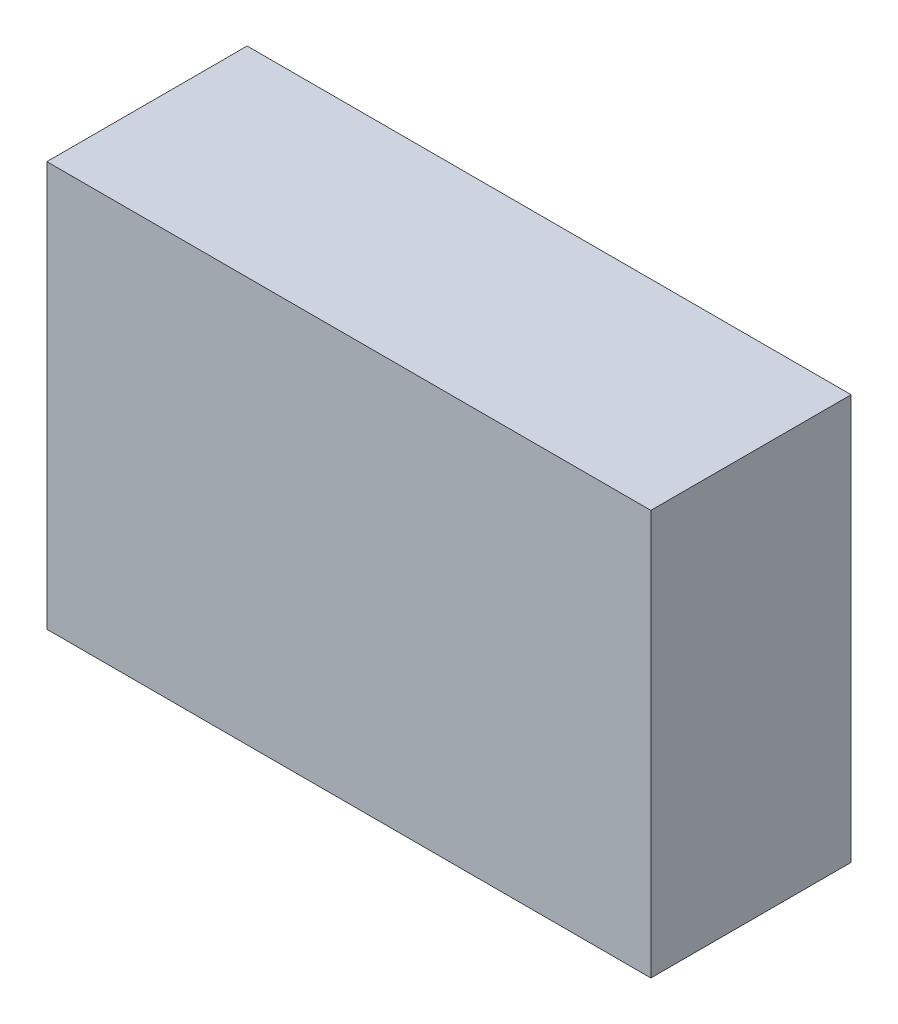
from build123d import *

# Parameters (mm, degrees)
ESQUISSE1_W        = 95
ESQUISSE1_H        = 63.7
BOSS_EXTRU_1_DEPTH = 31.5


with BuildPart() as part:
    # Esquisse1 → Boss.-Extru.1 (new body)
    with BuildSketch(Plane.XY):
        Rectangle(ESQUISSE1_W, ESQUISSE1_H)
    extrude(amount=BOSS_EXTRU_1_DEPTH)


solid = part.part
